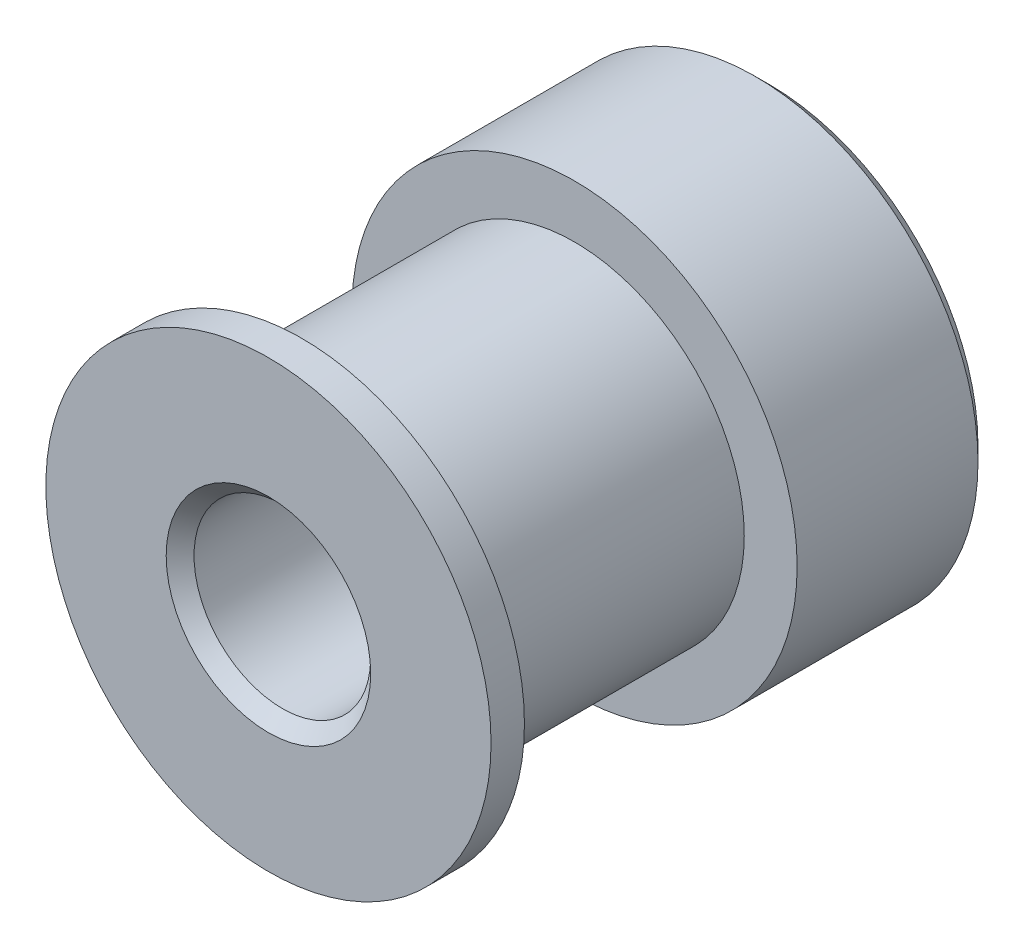
from build123d import *

# Parameters (mm, degrees)
CROQUIS1_R              = 8
SALIENTE_EXTRUIR1_DEPTH = 7
CROQUIS2_R              = 6.1
SALIENTE_EXTRUIR2_DEPTH = 9.8
CROQUIS3_R              = 8
SALIENTE_EXTRUIR3_DEPTH = 1.2
CROQUIS4_R              = 3.175
CORTAR_EXTRUIR1_DEPTH   = 22.260291625
CHAFL_N1_SIZE           = 0.5
CROQUIS5_R              = 1.5
CORTAR_EXTRUIR2_DEPTH   = 22.260291625
CROQUIS6_R              = 1.5
CORTAR_EXTRUIR3_DEPTH   = 22.260291701


with BuildPart() as part:
    # Croquis1 → Saliente-Extruir1 (new body)
    with BuildSketch(Plane.XY):
        Circle(CROQUIS1_R)
    extrude(amount=SALIENTE_EXTRUIR1_DEPTH)

    # Croquis2 → Saliente-Extruir2 (add)
    with BuildSketch(Plane.XY.offset(7)):
        Circle(CROQUIS2_R)
    extrude(amount=SALIENTE_EXTRUIR2_DEPTH)

    # Croquis3 → Saliente-Extruir3 (add)
    with BuildSketch(Plane.XY.offset(16.8)):
        Circle(CROQUIS3_R)
    extrude(amount=SALIENTE_EXTRUIR3_DEPTH)

    # Croquis4 → Cortar-Extruir1 (cut, through all)
    with BuildSketch(Plane.XY.offset(18)):
        Circle(CROQUIS4_R)
    extrude(amount=-CORTAR_EXTRUIR1_DEPTH, mode=Mode.SUBTRACT)

    # Chaflán1
    chafl_n1_edges = [part.edges().sort_by_distance(p)[0] for p in [
        (-3.175, 0, 0),
        (-3.175, 0, 18),
        (-8, 0, 0),
    ]]
    chamfer(chafl_n1_edges, length=CHAFL_N1_SIZE)

    # Croquis5 → Cortar-Extruir2 (cut, through all)
    with BuildSketch(Plane(origin=(0, 0, 0), x_dir=(0, 0, -1), z_dir=(1, 0, 0))):
        with Locations((-3.5, 0)):
            Circle(CROQUIS5_R)
    extrude(amount=-CORTAR_EXTRUIR2_DEPTH, mode=Mode.SUBTRACT)

    # Croquis6 → Cortar-Extruir3 (cut, through all)
    with BuildSketch(Plane(origin=(0, 0, 0), x_dir=(1, 0, 0), z_dir=(0, 1, 0))):
        with Locations(Location((0, -3.5, 0), (0, 0, 270))):
            Circle(CROQUIS6_R)
    extrude(amount=-CORTAR_EXTRUIR3_DEPTH, mode=Mode.SUBTRACT)


solid = part.part
